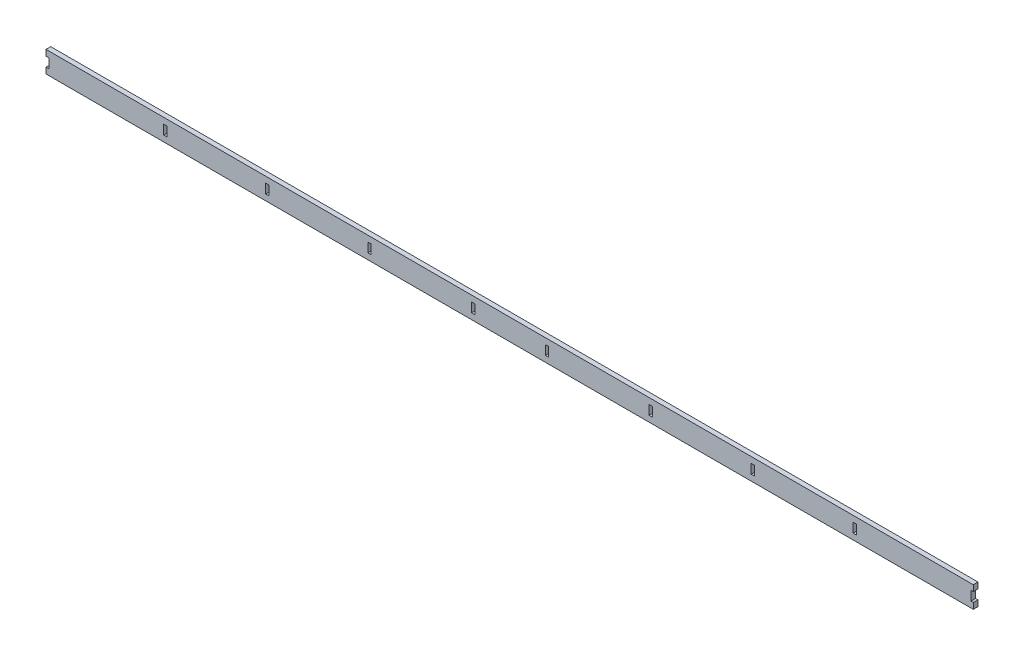
from build123d import *

# Parameters (mm, degrees)
EXTRUDE_1_DEPTH = 3


with BuildPart() as part:
    # Model → 凸台-拉伸1 (new body)
    with BuildSketch(Plane.XY):
        Polygon((594.4798768, 20.966777044), (3.683638592, 20.966777044), (3.683638592, 17.166777044), (5.683638592, 17.166777044), (5.683638592, 11.166777044), (3.683638592, 11.166777044), (3.683638592, 7.366777044), (594.4798768, 7.366777044), (594.4798768, 11.166777044), (592.9798768, 11.166777044), (592.9798768, 17.166777044), (594.4798768, 17.166777044), align=None)
        Polygon((78.683615423, 14.166777044), (78.683615423, 17.166777044), (80.683615423, 17.166777044), (80.683615423, 11.166777044), (78.683615423, 11.166777044), align=None, mode=Mode.SUBTRACT)
        Polygon((143.683592254, 14.166777044), (143.68359107, 17.166782765), (145.68359107, 17.166782765), (145.68359107, 11.166782765), (143.68359107, 11.166782765), align=None, mode=Mode.SUBTRACT)
        Polygon((208.683569086, 14.166777044), (208.683567901, 17.166782765), (210.683567901, 17.166782765), (210.683567901, 11.166782765), (208.683567901, 11.166782765), align=None, mode=Mode.SUBTRACT)
        Polygon((274.88354608, 14.166781952), (274.883544895, 17.166787672), (276.883544895, 17.166787672), (276.883544895, 11.166787672), (274.883544895, 11.166787672), align=None, mode=Mode.SUBTRACT)
        Polygon((321.883556192, 14.166781952), (321.883555007, 17.166787672), (323.883555007, 17.166787672), (323.883555007, 11.166787672), (321.883555007, 11.166787672), align=None, mode=Mode.SUBTRACT)
        Polygon((387.9799484, 14.166781952), (387.979947216, 17.166787672), (389.979947216, 17.166787672), (389.979947216, 11.166787672), (387.979947216, 11.166787672), align=None, mode=Mode.SUBTRACT)
        Polygon((452.979925232, 14.166781952), (452.979924047, 17.166787672), (454.979924047, 17.166787672), (454.979924047, 11.166787672), (452.979924047, 11.166787672), align=None, mode=Mode.SUBTRACT)
        Polygon((517.979902063, 14.166781952), (517.979900879, 17.166787672), (519.979900879, 17.166787672), (519.979900879, 11.166787672), (517.979900879, 11.166787672), align=None, mode=Mode.SUBTRACT)
    extrude(amount=EXTRUDE_1_DEPTH)


solid = part.part
